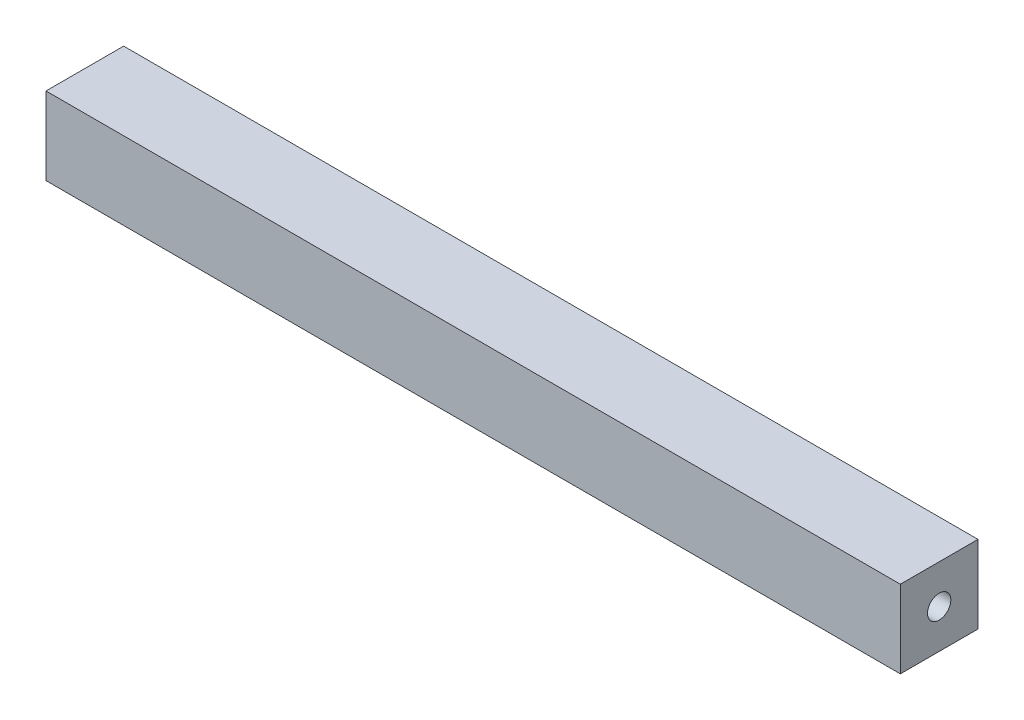
from build123d import *

# Parameters (mm, degrees)
SKETCH_1_W               = 110
SKETCH_1_H               = 10
EXTRUDE_1_DEPTH          = 10
CUT_EXTRUDE_1_DEPTH      = 57.124860802
CUT_EXTRUDE_1_DEPTH_BACK = 57.124860802
SKETCH_2_R               = 1.5


with BuildPart() as part:
    # ｽｹｯﾁ1 → ﾎﾞｽ - 押し出し1 (new body)
    with BuildSketch(Plane(origin=(0, 0, 0), x_dir=(1, 0, 0), z_dir=(0, 1, 0))):
        Rectangle(SKETCH_1_W, SKETCH_1_H)
    extrude(amount=EXTRUDE_1_DEPTH)

    # ｽｹｯﾁ2 → ｶｯﾄ - 押し出し1 (cut, two sides: drawn at the far end of the back side and taken through both)
    with BuildSketch(Plane(origin=(0, 0, 0), x_dir=(0, 0, -1), z_dir=(1, 0, 0)).offset(-CUT_EXTRUDE_1_DEPTH_BACK)):
        with Locations((0, 5)):
            Circle(SKETCH_2_R)
    extrude(amount=CUT_EXTRUDE_1_DEPTH + CUT_EXTRUDE_1_DEPTH_BACK, mode=Mode.SUBTRACT)


solid = part.part
